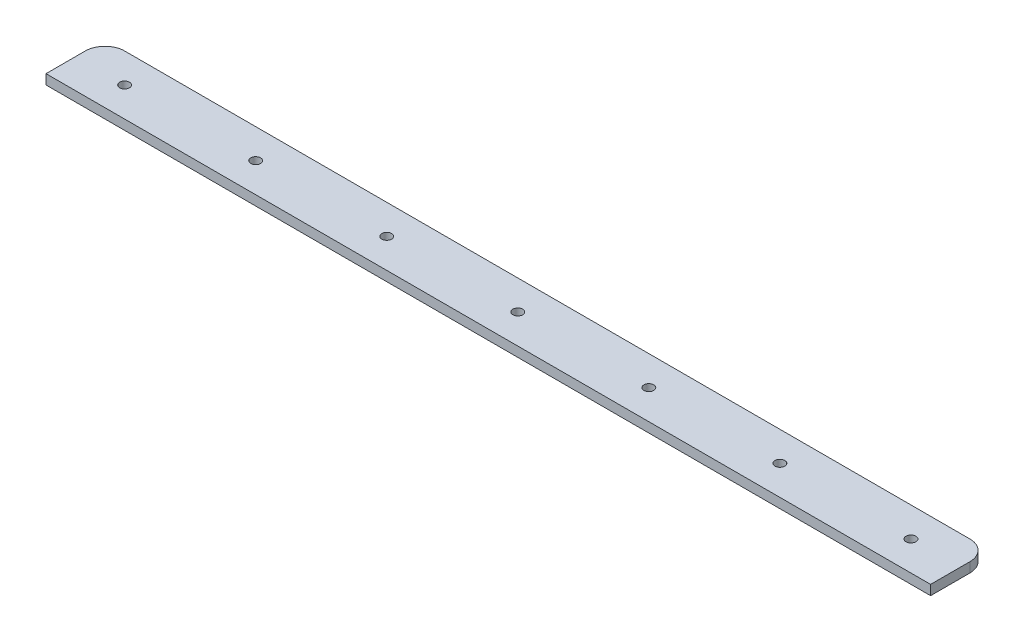
from build123d import *

# Parameters (mm, degrees)
BOSS_EXTRUDE1_DEPTH = 7.5
SKETCH2_R           = 7.5
CUT_EXTRUDE1_DEPTH  = 754.618053682


with BuildPart() as part:
    # Sketch1 → Boss-Extrude1 (new, symmetric)
    with BuildSketch(Plane(origin=(0, 0, 0), x_dir=(1, 0, 0), z_dir=(0, 1, 0))):
        with BuildLine():
            Line((-750, -17.783860282), (600, -17.783860282))
            Line((600, -17.783860282), (600, 42.216139718))
            ThreePointArc((600, 42.216139718), (591.213203436, 63.429343154), (570, 72.216139718))
            Line((570, 72.216139718), (-720, 72.216139718))
            ThreePointArc((-720, 72.216139718), (-741.213203436, 63.429343154), (-750, 42.216139718))
            Line((-750, 42.216139718), (-750, -17.783860282))
        make_face()
    extrude(amount=BOSS_EXTRUDE1_DEPTH, both=True)

    # Sketch2 → Cut-Extrude1 (cut, through all)
    with BuildSketch(Plane.XZ.offset(7.5)):
        with Locations(Location((-675, -27.216139718, 0), (0, 0, 270))):
            Circle(SKETCH2_R)
        with Locations(Location((-475, -27.216139718, 0), (0, 0, 270))):
            Circle(SKETCH2_R)
        with Locations(Location((-275, -27.216139718, 0), (0, 0, 270))):
            Circle(SKETCH2_R)
        with Locations(Location((-75, -27.216139718, 0), (0, 0, 270))):
            Circle(SKETCH2_R)
        with Locations(Location((125, -27.216139718, 0), (0, 0, 270))):
            Circle(SKETCH2_R)
        with Locations(Location((325, -27.216139718, 0), (0, 0, 270))):
            Circle(SKETCH2_R)
        with Locations(Location((525, -27.216139718, 0), (0, 0, 270))):
            Circle(SKETCH2_R)
    extrude(amount=-CUT_EXTRUDE1_DEPTH, mode=Mode.SUBTRACT)


solid = part.part
